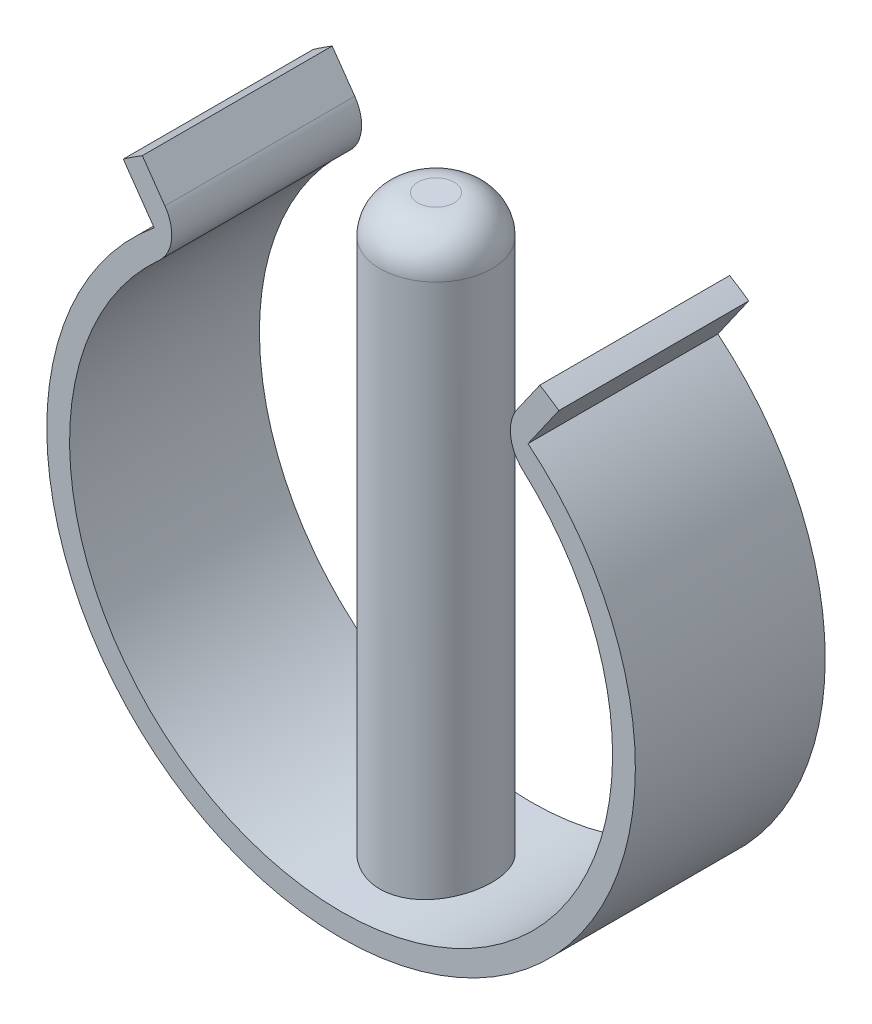
from build123d import *

# Parameters (mm, degrees)
BOSS_EXTRUDE1_DEPTH             = 5
BOSS_EXTRUDE1_DEPTH_BACK        = 5
SKETCH2_R                       = 2.95
BOSS_EXTRUDE2_DEPTH             = 16
BOSS_EXTRUDE2_DIRECTION_2_REACH = 24.483
FILLET2_R                       = 2
FILLET3_R                       = 2


with BuildPart() as part:
    # Sketch1 → Boss-Extrude1 (new, two sides: drawn at the far end of the back side and taken through both)
    with BuildSketch(Plane.XY.offset(-BOSS_EXTRUDE1_DEPTH_BACK)):
        with BuildLine():
            Line((8.20214304, 11.713874233), (10.467878905, 14.949680393))
            ThreePointArc((10.467878905, 14.949680393), (10.974647974, 14.627825025), (11.471528727, 14.290904731))
            Line((11.471528727, 14.290904731), (9.846733622, 11.970456841))
            ThreePointArc((9.846733622, 11.970456841), (0, -15.5), (-9.846733622, 11.970456841))
            Line((-9.846733622, 11.970456841), (-11.471528727, 14.290904731))
            ThreePointArc((-11.471528727, 14.290904731), (-10.974647974, 14.627825025), (-10.467878905, 14.949680393))
            Line((-10.467878905, 14.949680393), (-8.20214304, 11.713874233))
            ThreePointArc((-8.20214304, 11.713874233), (0, -14.3), (8.20214304, 11.713874233))
        make_face()
    extrude(amount=BOSS_EXTRUDE1_DEPTH + BOSS_EXTRUDE1_DEPTH_BACK)

    # Sketch2 → Boss-Extrude2 (add)
    with BuildSketch(Plane(origin=(0, 0, 0), x_dir=(1, 0, 0), z_dir=(0, 1, 0))):
        Circle(SKETCH2_R)
    extrude(amount=BOSS_EXTRUDE2_DEPTH)

    # Sketch2 → Boss-Extrude2 direction 2 (add, up to next)
    with BuildSketch(Plane(origin=(0, 0, 0), x_dir=(1, 0, 0), z_dir=(0, 1, 0)), mode=Mode.PRIVATE) as boss_extrude2_direction_2_sk1:
        Circle(SKETCH2_R)
    boss_extrude2_direction_2_tool1 = extrude(boss_extrude2_direction_2_sk1.sketch, amount=-BOSS_EXTRUDE2_DIRECTION_2_REACH, mode=Mode.PRIVATE) - part.part
    add(boss_extrude2_direction_2_tool1.solids().sort_by_distance((0, 0, 0))[0])

    # Fillet2
    fillet2_edges = [part.edges().sort_by_distance(p)[0] for p in [
        (-2.95, 16, 0),
    ]]
    fillet(fillet2_edges, radius=FILLET2_R)

    # Fillet3
    fillet3_edges = [part.edges().sort_by_distance(p)[0] for p in [
        (8.20214304, 11.713874233, 0),
        (-8.20214304, 11.713874233, 0),
    ]]
    fillet(fillet3_edges, radius=FILLET3_R)

    # Sketch4 → Revolve1 (revolve)
    with BuildSketch(Plane(origin=(0, 0, 0), x_dir=(0, 0, -1), z_dir=(1, 0, 0))):
        with BuildLine():
            Line((0, -14.986224552), (-4.696335741, -14.986224552))
            ThreePointArc((-4.696335741, -14.986224552), (-2.444681768, -15.973915756), (0, -16.236614408))
            Line((0, -16.236614408), (0, -14.986224552))
        make_face()
    revolve(axis=Axis((0, -14.986224552, 0), (0, 1, 0)))


solid = part.part
